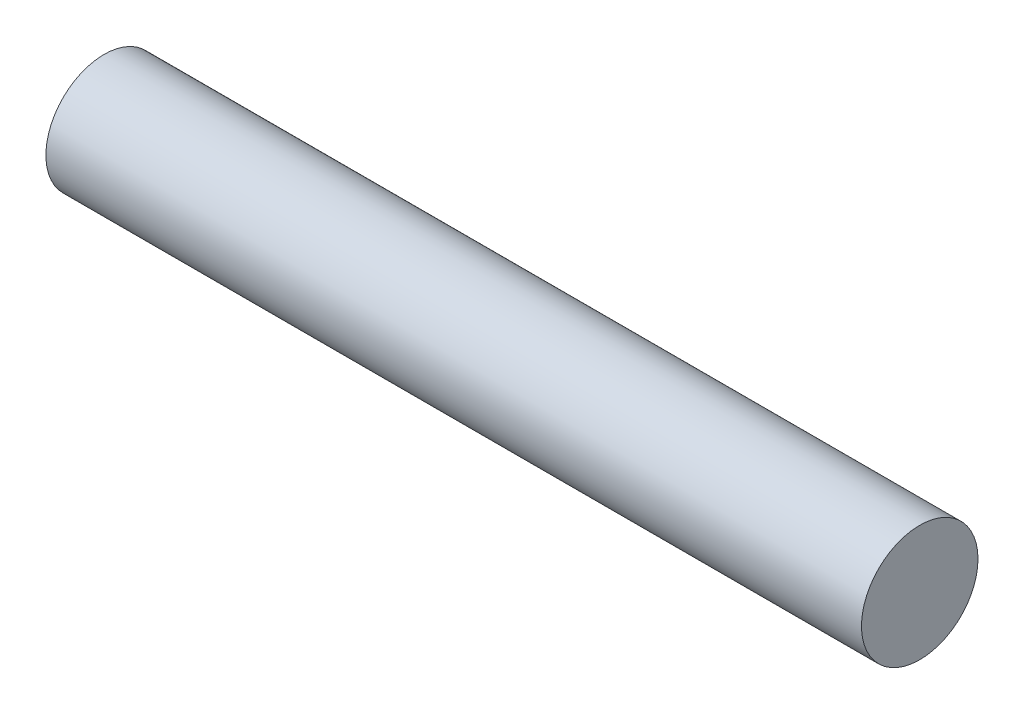
from build123d import *

# Parameters (mm, degrees)
SKETCH1_R           = 1
BOSS_EXTRUDE1_DEPTH = 14


with BuildPart() as part:
    # Sketch1 → Boss-Extrude1 (new body)
    with BuildSketch(Plane(origin=(0, 0, 0), x_dir=(0, 0, -1), z_dir=(1, 0, 0))):
        Circle(SKETCH1_R)
    extrude(amount=BOSS_EXTRUDE1_DEPTH)


solid = part.part
